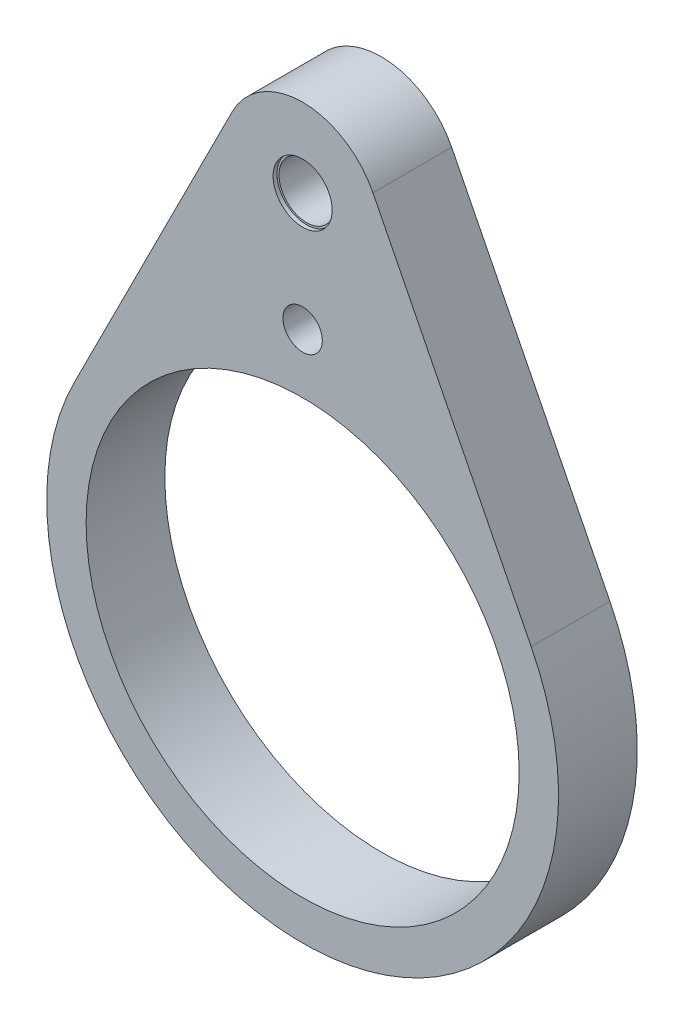
from build123d import *

# Parameters (mm, degrees)
SKETCH2_R           = 5
BOSS_EXTRUDE1_DEPTH = 10
SKETCH3_R           = 10
SKETCH3_R_2         = 5
BOSS_EXTRUDE2_DEPTH = 76.2
BOSS_EXTRUDE3_START = 86.2
SKETCH2_2_R         = 5
BOSS_EXTRUDE3_DEPTH = 20
SKETCH5_R           = 65
BOSS_EXTRUDE4_DEPTH = 20
SKETCH6_R           = 55
CUT_EXTRUDE1_DEPTH  = 20
SKETCH7_R           = 80
CUT_EXTRUDE2_DEPTH  = 135.370532484
SKETCH8_R           = 7
BOSS_EXTRUDE6_DEPTH = 20
SKETCH9_R           = 7.5
CUT_EXTRUDE3_DEPTH  = 1
CUT_EXTRUDE4_START  = -1
SKETCH10_R          = 7.5
CUT_EXTRUDE4_DEPTH  = 1


with BuildPart() as part:
    # Sketch2 → Boss-Extrude1 (new body)
    with BuildSketch(Plane.XY):
        with BuildLine():
            Line((-19.794866372, 2.857142857), (-9.897433186, 71.428571429))
            ThreePointArc((-9.897433186, 71.428571429), (0, 80), (9.897433186, 71.428571429))
            Line((9.897433186, 71.428571429), (19.794866372, 2.857142857))
            ThreePointArc((19.794866372, 2.857142857), (0, -20), (-19.794866372, 2.857142857))
        make_face()
        with Locations((0, 70)):
            Circle(SKETCH2_R, mode=Mode.SUBTRACT)
        with BuildLine():
            Line((-2.5, 9.682458366), (-2.5, 12))
            Line((-2.5, 12), (2.5, 12))
            Line((2.5, 12), (2.5, 9.682458366))
            ThreePointArc((2.5, 9.682458366), (0, -10), (-2.5, 9.682458366))
        make_face(mode=Mode.SUBTRACT)
    extrude(amount=BOSS_EXTRUDE1_DEPTH)

    # Sketch3 → Boss-Extrude2 (add)
    with BuildSketch(Plane.XY.offset(10)):
        with Locations(Location((0, 70, 0), (0, 0, 171.786789298))):
            Circle(SKETCH3_R)
        with Locations((0, 70)):
            Circle(SKETCH3_R_2, mode=Mode.SUBTRACT)
    extrude(amount=BOSS_EXTRUDE2_DEPTH)

    # Sketch2<2> → Boss-Extrude3 (add)
    with BuildSketch(Plane.XY.offset(BOSS_EXTRUDE3_START)):
        with BuildLine():
            Line((-19.794866372, 2.857142857), (-9.897433186, 71.428571429))
            ThreePointArc((-9.897433186, 71.428571429), (0, 80), (9.897433186, 71.428571429))
            Line((9.897433186, 71.428571429), (19.794866372, 2.857142857))
            ThreePointArc((19.794866372, 2.857142857), (0, -20), (-19.794866372, 2.857142857))
        make_face()
        with Locations((0, 70)):
            Circle(SKETCH2_2_R, mode=Mode.SUBTRACT)
        with BuildLine():
            Line((-2.5, 9.682458366), (-2.5, 12))
            Line((-2.5, 12), (2.5, 12))
            Line((2.5, 12), (2.5, 9.682458366))
            ThreePointArc((2.5, 9.682458366), (0, -10), (-2.5, 9.682458366))
        make_face(mode=Mode.SUBTRACT)
    extrude(amount=BOSS_EXTRUDE3_DEPTH)

    # Sketch5 → Boss-Extrude4 (add)
    with BuildSketch(Plane.XY.offset(106.2)):
        Circle(SKETCH5_R)
    extrude(amount=-BOSS_EXTRUDE4_DEPTH)

    # Sketch6 → Cut-Extrude1 (cut)
    with BuildSketch(Plane.XY.offset(106.2)):
        Circle(SKETCH6_R)
    extrude(amount=-CUT_EXTRUDE1_DEPTH, mode=Mode.SUBTRACT)

    # Sketch7 → Cut-Extrude2 (cut, through all)
    with BuildSketch(Plane(origin=(0, 0, 86.2), x_dir=(-1, 0, 0), z_dir=(0, 0, -1))):
        Circle(SKETCH7_R)
    extrude(amount=CUT_EXTRUDE2_DEPTH, mode=Mode.SUBTRACT)

    # Sketch8 → Boss-Extrude6 (add)
    with BuildSketch(Plane.XY.offset(106.2)):
        with BuildLine():
            Line((-17.860571099, 109), (-58.046856073, 29.25))
            ThreePointArc((-58.046856073, 29.25), (-38.646753366, 52.263069698), (-10.959640032, 64.06938653))
            Line((-10.959640032, 64.06938653), (-9.897433186, 71.428571429))
            ThreePointArc((-9.897433186, 71.428571429), (0, 80), (9.897433186, 71.428571429))
            Line((9.897433186, 71.428571429), (10.959640032, 64.06938653))
            ThreePointArc((10.959640032, 64.06938653), (38.646753366, 52.263069698), (58.046856073, 29.25))
            Line((58.046856073, 29.25), (17.860571099, 109))
            ThreePointArc((17.860571099, 109), (0, 120), (-17.860571099, 109))
        make_face()
        with Locations((0, 100)):
            Circle(SKETCH8_R, mode=Mode.SUBTRACT)
    extrude(amount=-BOSS_EXTRUDE6_DEPTH)

    # Sketch9 → Cut-Extrude3 (cut)
    with BuildSketch(Plane.XY.offset(106.2)):
        with Locations((0, 100)):
            Circle(SKETCH9_R)
    extrude(amount=-CUT_EXTRUDE3_DEPTH, mode=Mode.SUBTRACT)

    # Sketch10 → Cut-Extrude4 (cut)
    with BuildSketch(Plane(origin=(0, 0, 86.2), x_dir=(-1, 0, 0), z_dir=(0, 0, -1)).offset(CUT_EXTRUDE4_START)):
        with Locations(Location((0, 100, 0), (0, 0, 180))):
            Circle(SKETCH10_R)
    extrude(amount=CUT_EXTRUDE4_DEPTH, mode=Mode.SUBTRACT)


solid = part.part
